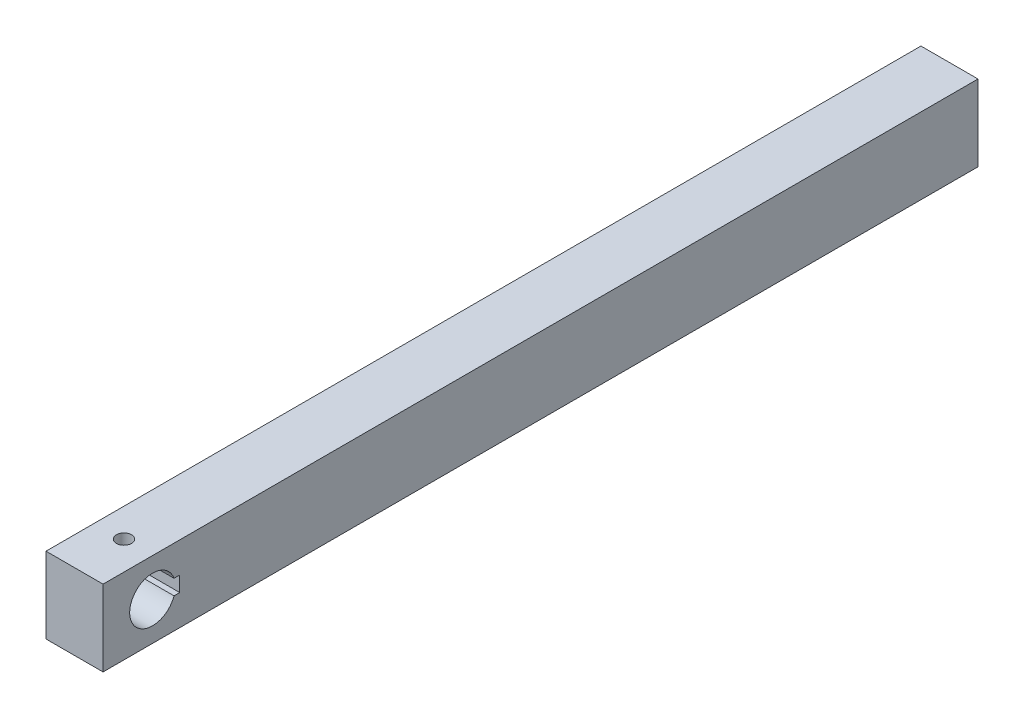
from build123d import *

# Parameters (mm, degrees)
SKETCH1_W            = 15
SKETCH1_H            = 20
BOSS_EXTRUDE1_DEPTH  = 230
SKETCH2_W            = 65
SKETCH2_H            = 40
BOSS_EXTRUDE6_DEPTH  = 5
SKETCH7_W            = 75
SKETCH7_H            = 15
BOSS_EXTRUDE7_DEPTH  = 5
SKETCH8_W            = 75
SKETCH8_H            = 15
BOSS_EXTRUDE8_DEPTH  = 5
SKETCH9_W            = 65
SKETCH9_H            = 40
BOSS_EXTRUDE11_DEPTH = 5
CUT_EXTRUDE1_DEPTH   = 240.635139326
SKETCH13_R           = 1.984375
CUT_EXTRUDE2_DEPTH   = 10


with BuildPart() as part:
    # Sketch1 → Boss-Extrude1 (new body)
    with BuildSketch(Plane.XY):
        Rectangle(SKETCH1_W, SKETCH1_H)
    extrude(amount=BOSS_EXTRUDE1_DEPTH)

    # Sketch10 → Cut-Extrude1 (cut, through all)
    with BuildSketch(Plane.ZY.offset(7.5)):
        with BuildLine():
            Line((209.843145751, 2), (211.343145751, 2))
            ThreePointArc((211.343145751, 2), (223, 0), (211.343145751, -2))
            Line((211.343145751, -2), (209.843145751, -2))
            Line((209.843145751, -2), (209.843145751, 2))
        make_face()
    extrude(amount=-CUT_EXTRUDE1_DEPTH, mode=Mode.SUBTRACT)

    # Sketch13 → Cut-Extrude2 (cut)
    with BuildSketch(Plane(origin=(0, 10, 0), x_dir=(1, 0, 0), z_dir=(0, 1, 0))):
        with Locations(Location((0, -217, 0), (0, 0, 270))):
            Circle(SKETCH13_R)
    extrude(amount=-CUT_EXTRUDE2_DEPTH, mode=Mode.SUBTRACT)


with BuildPart() as body_2:
    # Sketch2 → Boss-Extrude6 (new body)
    with BuildSketch(Plane(origin=(0, 0, 0), x_dir=(-1, 0, 0), z_dir=(0, 0, -1))):
        with Locations((0, 30)):
            Rectangle(SKETCH2_W, SKETCH2_H)
    extrude(amount=-BOSS_EXTRUDE6_DEPTH)


with BuildPart() as body_3:
    # Sketch7 → Boss-Extrude7 (new body)
    with BuildSketch(Plane(origin=(32.5, 0, 0), x_dir=(0, 0, -1), z_dir=(1, 0, 0))):
        with Locations((-37.5, 30)):
            Rectangle(SKETCH7_W, SKETCH7_H)
    extrude(amount=BOSS_EXTRUDE7_DEPTH)


with BuildPart() as body_4:
    # Sketch8 → Boss-Extrude8 (new body)
    with BuildSketch(Plane.ZY.offset(32.5)):
        with Locations((37.5, 30)):
            Rectangle(SKETCH8_W, SKETCH8_H)
    extrude(amount=BOSS_EXTRUDE8_DEPTH)


with BuildPart() as body_5:
    # Sketch9 → Boss-Extrude11 (new body)
    with BuildSketch(Plane.XY.offset(75)):
        with Locations((0, 30)):
            Rectangle(SKETCH9_W, SKETCH9_H)
    extrude(amount=-BOSS_EXTRUDE11_DEPTH)


solid = part.part
